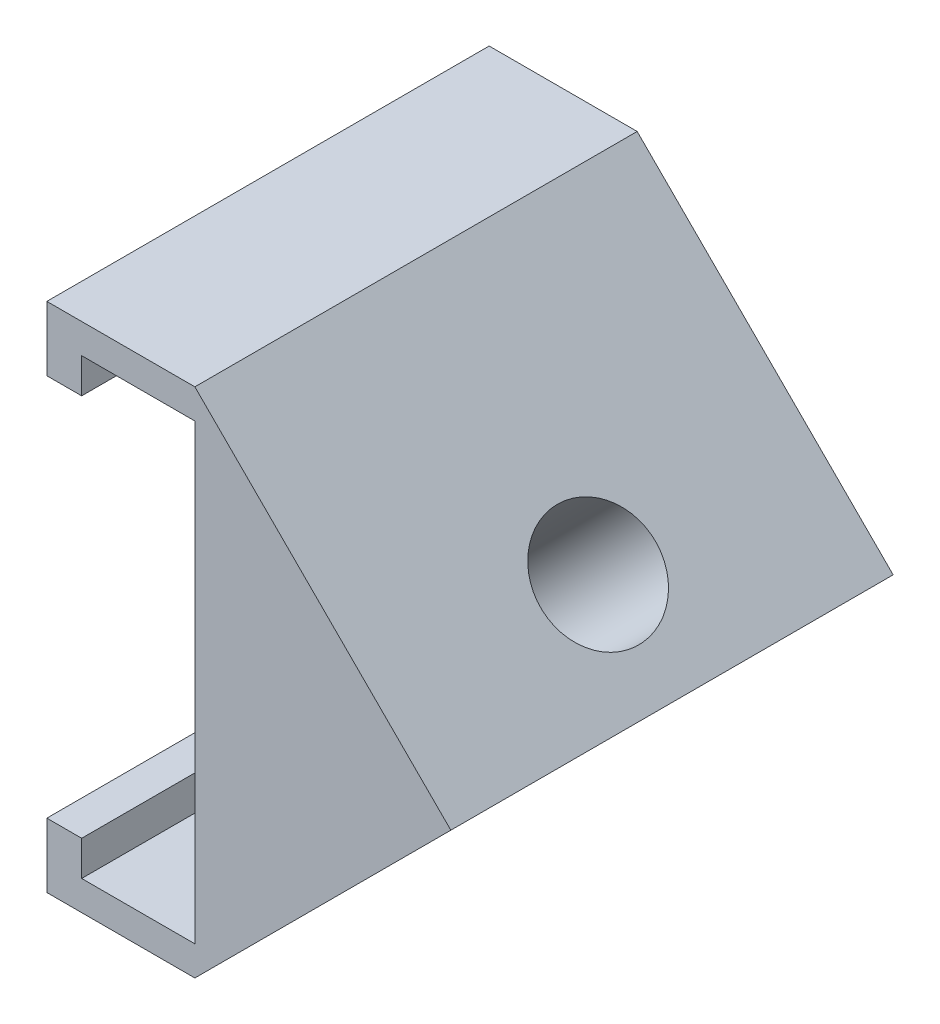
from build123d import *

# Parameters (mm, degrees)
BOSS_EXTRUDE1_DEPTH = 12.7
SKETCH7_R           = 1.65
CUT_EXTRUDE2_DEPTH  = 5


with BuildPart() as part:
    # Sketch1 → Boss-Extrude1 (new body)
    with BuildSketch(Plane.XY):
        Polygon((-7.35, 7.35), (0, 0), (-7.35, -7.35), (-11.6, -7.35), (-11.6, -6.5), (-11.6, -5.5), (-10.6, -5.5), (-10.6, -6.5), (-7.35, -6.5), (-7.35, 6.5), (-10.6, 6.5), (-10.6, 5.5), (-11.6, 5.5), (-11.6, 6.5), (-11.6, 7.35), align=None)
    extrude(amount=BOSS_EXTRUDE1_DEPTH)

    # Sketch7 → Cut-Extrude2 (cut)
    with BuildSketch(Plane(origin=(0, 0, 0), x_dir=(0, 0, -1), z_dir=(0.7071067811865724, 0.7071067811865226, 0))):
        with Locations(Location((-6.35, 3, 0), (0, 0, 90))):
            Circle(SKETCH7_R)
    extrude(amount=-CUT_EXTRUDE2_DEPTH, mode=Mode.SUBTRACT)


solid = part.part
